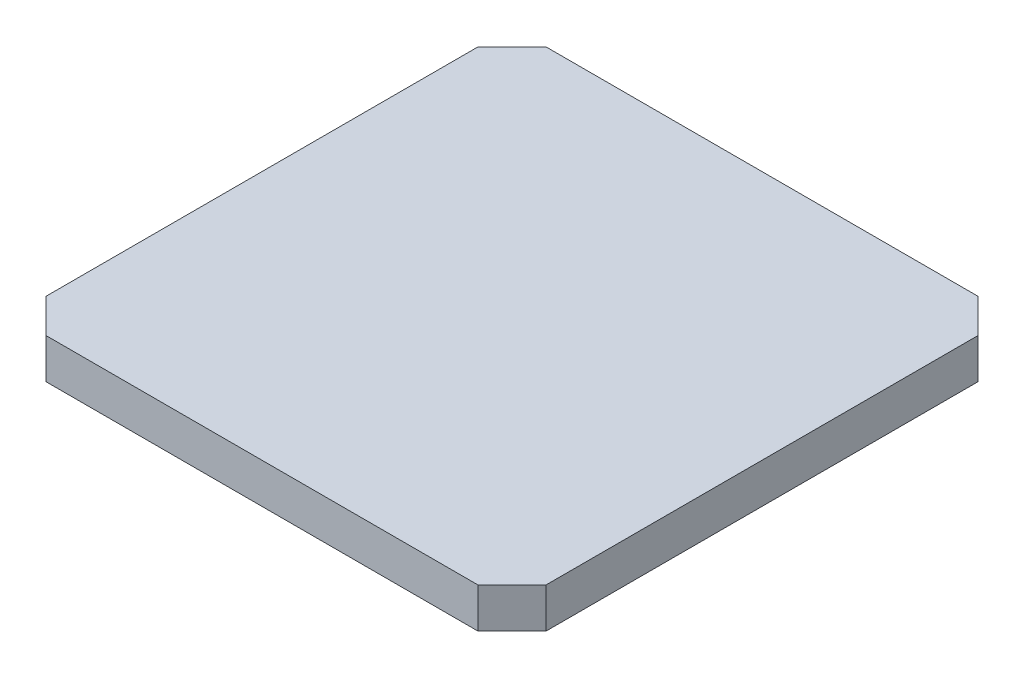
from build123d import *

# Parameters (mm, degrees)
GPS_ANTENNA_DEPTH = 2


with BuildPart() as part:
    # Sketch1 → GPS Antenna (new body)
    with BuildSketch(Plane(origin=(0, 0, 0), x_dir=(1, 0, 0), z_dir=(0, 1, 0))):
        Polygon((0, 1.7), (1.7, 0), (23.3, 0), (25, 1.7), (25, 23.3), (23.3, 25), (1.7, 25), (0, 23.3), align=None)
    extrude(amount=GPS_ANTENNA_DEPTH)


solid = part.part
